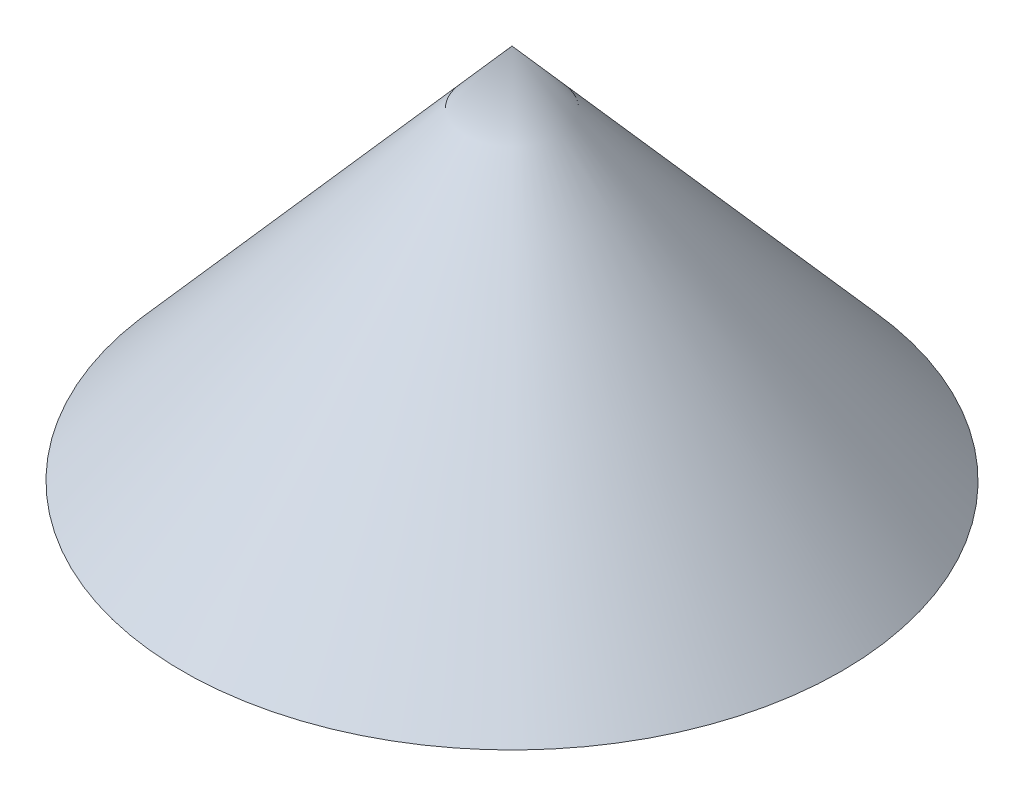
from build123d import *


with BuildPart() as part:
    # Esboço1 → Revolução1 (revolve)
    with BuildSketch(Plane.XY, mode=Mode.PRIVATE) as revolu_o1_sk:
        Polygon((0, 0), (-0.7, 0), (0, 0.8), align=None)
    revolve(revolu_o1_sk.sketch.rotate(Axis((0, 0.8, 0), (0, -1, 0)), 180), axis=Axis((0, 0.8, 0), (0, -1, 0)))


solid = part.part
